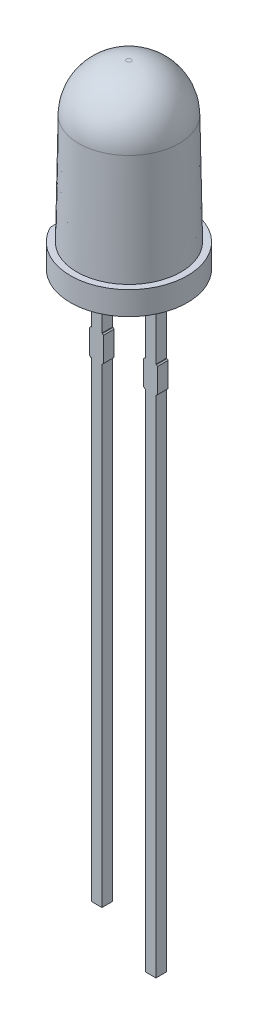
from build123d import *

# Parameters (mm, degrees)
SKETCH1_R           = 2.75
BOSS_EXTRUDE1_DEPTH = 1.1
SKETCH2_R           = 2.45
DRAFT1_ANGLE        = 1
FILLET1_R           = 2.25
CUT_EXTRUDE1_START  = -1.1
CUT_EXTRUDE1_DEPTH  = 1.1
SKETCH6_W           = 0.5
SKETCH6_H           = 0.5
BOSS_EXTRUDE2_DEPTH = 28
MOVE_FACE1_BY       = 1.6
SKETCH7_W           = 0.65
SKETCH7_H           = 1.25
BOSS_EXTRUDE3_DEPTH = 0.5
CHAMFER1_SIZE       = 0.05


with BuildPart() as part:
    # Sketch1 → Boss-Extrude1 (new body)
    with BuildSketch(Plane(origin=(0, 0, 0), x_dir=(1, 0, 0), z_dir=(0, 1, 0))):
        with Locations(Location((0, 0, 0), (0, 0, 270))):
            Circle(SKETCH1_R)
    extrude(amount=BOSS_EXTRUDE1_DEPTH)

    # Sweep1: sweep along a path in Sketch3
    with BuildLine(Plane.XY) as sweep1_path:
        Line((0, 1.1), (0, 8.5))
    # Sketch2 → Sweep1 (sweep)
    with BuildSketch(Plane(origin=(0, 1.1, 0), x_dir=(1, 0, 0), z_dir=(0, 1, 0))):
        Circle(SKETCH2_R)
    sweep(path=sweep1_path.line)

    # Draft1
    draft1_faces = [part.faces().sort_by_distance(p)[0] for p in [
        (-2.45, 4.8, 0),
    ]]
    draft(draft1_faces, Plane.ZX.offset(1.1), DRAFT1_ANGLE)

    # Fillet1
    fillet1_edges = [part.edges().sort_by_distance(p)[0] for p in [
        (-2.32083252, 8.5, 0),
    ]]
    fillet(fillet1_edges, radius=FILLET1_R)

    # Sketch5 → Cut-Extrude1 (cut)
    with BuildSketch(Plane(origin=(0, 1.1, 0), x_dir=(1, 0, 0), z_dir=(0, 1, 0)).offset(CUT_EXTRUDE1_START)):
        with BuildLine():
            Line((-2.45, 1.2489996), (-2.45, -1.2489996))
            ThreePointArc((-2.45, -1.2489996), (-2.75, 0), (-2.45, 1.2489996))
        make_face()
    extrude(amount=CUT_EXTRUDE1_DEPTH, mode=Mode.SUBTRACT)

    # Sketch6 → Boss-Extrude2 (add)
    with BuildSketch(Plane.XZ):
        with Locations((-1.27, 0)):
            Rectangle(SKETCH6_W, SKETCH6_H)
        with Locations((1.27, 0)):
            Rectangle(SKETCH6_W, SKETCH6_H)
    extrude(amount=BOSS_EXTRUDE2_DEPTH)

    # Move Face1: a face moved inward by 1.6
    extrude(part.faces().sort_by_distance((-1.27, -28, 0))[0], amount=MOVE_FACE1_BY, dir=(0, 1, 0), mode=Mode.SUBTRACT)

    # Sketch7 → Boss-Extrude3 (add)
    with BuildSketch(Plane.XY.offset(0.25)):
        with Locations((1.27, -3.625)):
            Rectangle(SKETCH7_W, SKETCH7_H)
        with Locations((-1.27, -3.625)):
            Rectangle(SKETCH7_W, SKETCH7_H)
    extrude(amount=-BOSS_EXTRUDE3_DEPTH)

    # Chamfer1
    chamfer1_edges = [part.edges().sort_by_distance(p)[0] for p in [
        (0.945, -3, 0),
        (1.595, -4.25, 0),
        (0.945, -4.25, 0),
        (1.595, -3, 0),
        (-1.595, -3, 0),
        (-0.945, -4.25, 0),
        (-1.595, -4.25, 0),
        (-0.945, -3, 0),
    ]]
    chamfer(chamfer1_edges, length=CHAMFER1_SIZE)


solid = part.part
